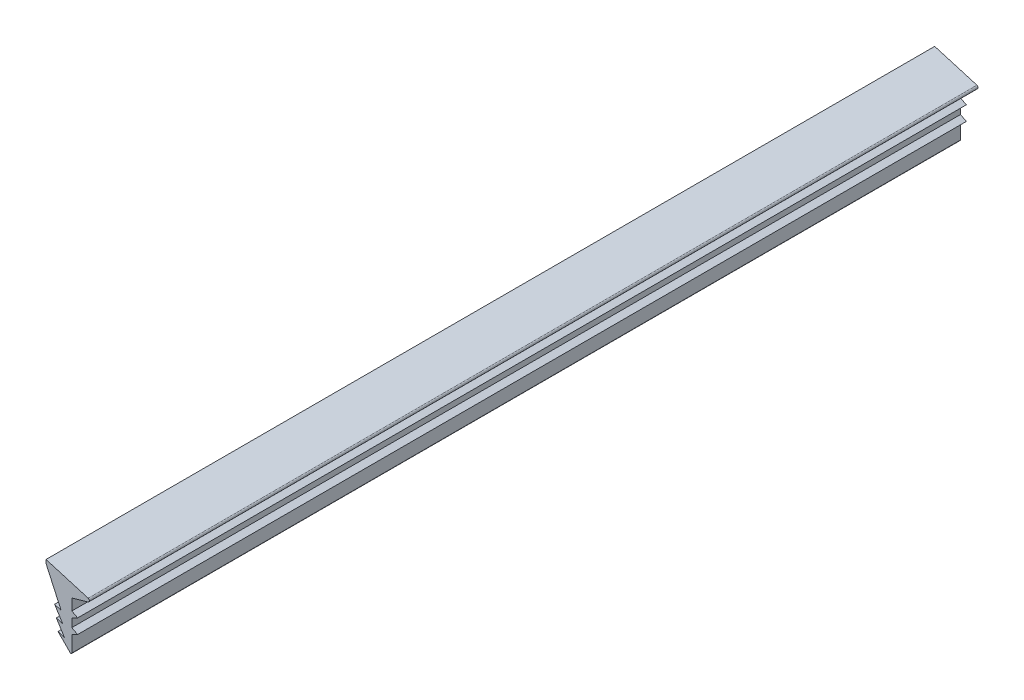
from build123d import *

# Parameters (mm, degrees)
EXTRUDE_1_DEPTH = 100


with BuildPart() as part:
    # 草图1 → 凸台-拉伸1 (new body)
    with BuildSketch(Plane.XY):
        with BuildLine():
            Line((1.910511393, 6.357959232), (-2.838177965, 7.757123338))
            Line((-2.838177965, 7.757123338), (-2.838177965, 7.373559769))
            Line((-2.838177965, 7.373559769), (-1.131654309, 3.630979973))
            Line((-1.131654309, 3.630979973), (-1.866356806, 3.881090486))
            Line((-1.866356806, 3.881090486), (-0.940400183, 2.396674584))
            Line((-0.940400183, 2.396674584), (-1.67510268, 2.646785097))
            Line((-1.67510268, 2.646785097), (-0.749146057, 1.162369196))
            Line((-0.749146057, 1.162369196), (-1.483848554, 1.412479708))
            Line((-1.483848554, 1.412479708), (-0.109115741, 0.02218372))
            ThreePointArc((-0.109115741, 0.02218372), (0, 0), (0.061991812, 0.092495284))
            Line((0.061991812, 0.092495284), (0.061991812, 1.893178292))
            Line((0.061991812, 1.893178292), (0.725818023, 2.227560058))
            Line((0.725818023, 2.227560058), (0.061991812, 2.561941824))
            Line((0.061991812, 2.561941824), (0.061991812, 3.512604418))
            Line((0.061991812, 3.512604418), (0.725818023, 3.846986184))
            Line((0.725818023, 3.846986184), (0.061991812, 4.18136795))
            Line((0.061991812, 4.18136795), (0.061991812, 5.461024264))
            Line((0.061991812, 5.461024264), (1.89024786, 5.980114276))
            ThreePointArc((1.89024786, 5.980114276), (2.035334753, 6.161799215), (1.910511393, 6.357959232))
        make_face()
    extrude(amount=EXTRUDE_1_DEPTH)


solid = part.part
